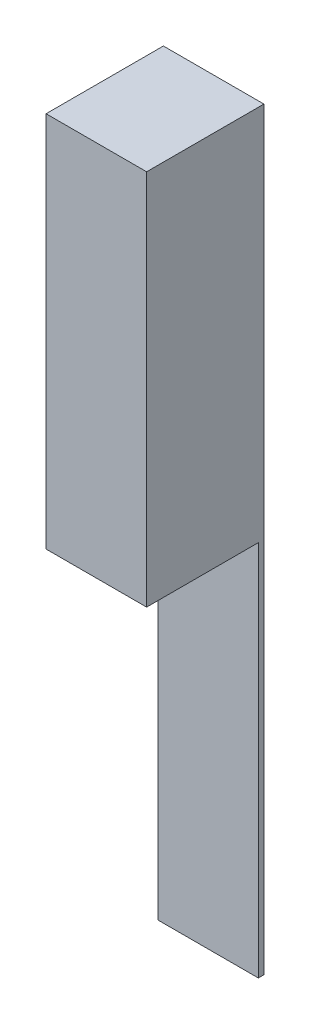
from build123d import *

# Parameters (mm, degrees)
SKETCH_1_W      = 180
SKETCH_1_H      = 1350
EXTRUDE_1_DEPTH = 10
SKETCH_2_W      = 180
SKETCH_2_H      = 675
EXTRUDE_2_DEPTH = 200
SCALE_1_SCALE   = 0.345


with BuildPart() as part:
    # 草图1 → 凸台-拉伸1 (new body)
    with BuildSketch(Plane.XY):
        with Locations((76.977478815, -652.957853403)):
            Rectangle(SKETCH_1_W, SKETCH_1_H)
    extrude(amount=EXTRUDE_1_DEPTH)

    # 草图2 → 凸台-拉伸2 (add)
    with BuildSketch(Plane.XY.offset(10)):
        with Locations((76.977478815, -315.457853403)):
            Rectangle(SKETCH_2_W, SKETCH_2_H)
    extrude(amount=EXTRUDE_2_DEPTH)


with BuildPart() as part_1:
    # 缩放比例1: scaled about (0, 0, 0)
    add(part.part.scale(SCALE_1_SCALE))


solid = part_1.part
